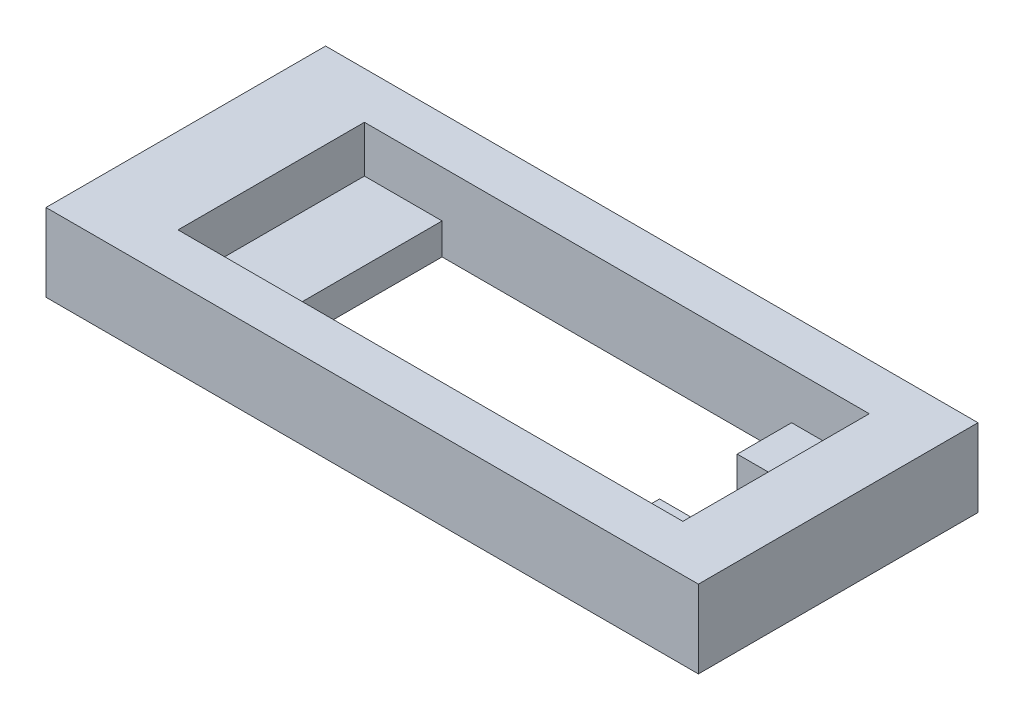
from build123d import *

# Parameters (mm, degrees)
SKETCH1_W           = 42
SKETCH1_H           = 5.00807777
BOSS_EXTRUDE1_DEPTH = 18
SKETCH2_W           = 32.5
SKETCH2_H           = 12
CUT_EXTRUDE1_DEPTH  = 3
CUT_EXTRUDE2_REACH  = 29.821
SKETCH3_W           = 22.5
SKETCH3_H           = 12
CUT_EXTRUDE3_REACH  = 29.821
SKETCH4_W           = 5
SKETCH4_H           = 5


with BuildPart() as part:
    # Sketch1 → Boss-Extrude1 (new body)
    with BuildSketch(Plane.XY):
        with Locations((0, -2.504038885)):
            Rectangle(SKETCH1_W, SKETCH1_H)
    extrude(amount=BOSS_EXTRUDE1_DEPTH)

    # Sketch2 → Cut-Extrude1 (cut)
    with BuildSketch(Plane(origin=(0, 0, 0), x_dir=(1, 0, 0), z_dir=(0, 1, 0))):
        with Locations((0.75, -9)):
            Rectangle(SKETCH2_W, SKETCH2_H)
    extrude(amount=-CUT_EXTRUDE1_DEPTH, mode=Mode.SUBTRACT)

    # Sketch3 → Cut-Extrude2 (cut, up to next)
    with BuildSketch(Plane(origin=(0, -3, 0), x_dir=(1, 0, 0), z_dir=(0, 1, 0)), mode=Mode.PRIVATE) as cut_extrude2_sk1:
        with Locations((0.75, -9)):
            Rectangle(SKETCH3_W, SKETCH3_H)
    cut_extrude2_tool1 = extrude(cut_extrude2_sk1.sketch, amount=-CUT_EXTRUDE2_REACH, mode=Mode.PRIVATE) & part.part
    add(cut_extrude2_tool1.solids().sort_by_distance((0.75, -3, 9))[0], mode=Mode.SUBTRACT)

    # Sketch4 → Cut-Extrude3 (cut, up to next)
    with BuildSketch(Plane(origin=(0, -3, 0), x_dir=(1, 0, 0), z_dir=(0, 1, 0)), mode=Mode.PRIVATE) as cut_extrude3_sk1:
        with Locations((14.5, -9)):
            Rectangle(SKETCH4_W, SKETCH4_H)
    cut_extrude3_tool1 = extrude(cut_extrude3_sk1.sketch, amount=-CUT_EXTRUDE3_REACH, mode=Mode.PRIVATE) & part.part
    add(cut_extrude3_tool1.solids().sort_by_distance((14.5, -3, 9))[0], mode=Mode.SUBTRACT)


solid = part.part
